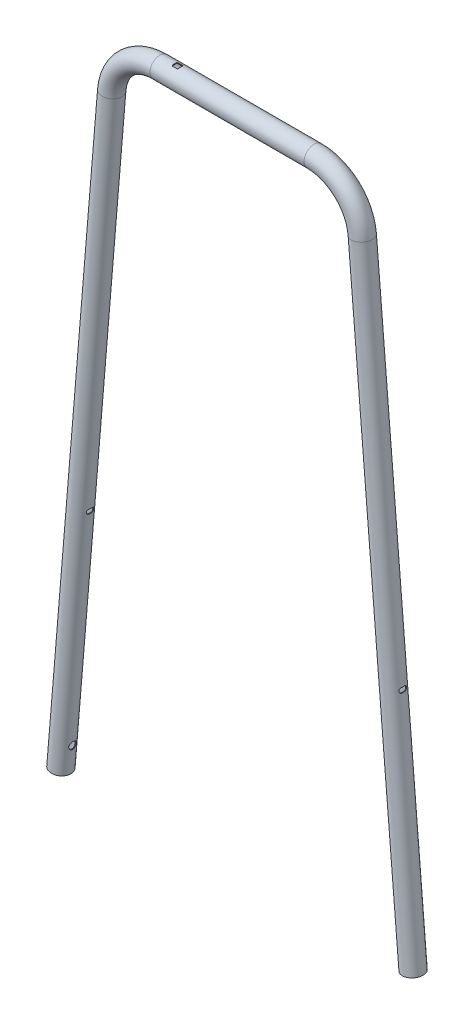
from build123d import *

# Parameters (mm, degrees)
SKETCH2_R           = 11
SKETCH2_R_2         = 10.2
SKETCH17_R          = 4
CUT_EXTRUDE6_DEPTH  = 50
CUT_EXTRUDE7_DEPTH  = 50
SKETCH19_R          = 4
CUT_EXTRUDE8_DEPTH  = 50
SKETCH20_R          = 3.1
CUT_EXTRUDE9_DEPTH  = 50
CUT_EXTRUDE10_DEPTH = 10


with BuildPart() as part:
    # Sweep2: sweep along a path in Sketch1
    with BuildLine(Plane.XY) as sweep2_path:
        Line((193, -162.284032228), (137.294983498, 508.10480277))
        ThreePointArc((137.294983498, 508.10480277), (120.368457539, 542.713456504), (84.477011865, 556.715967772))
        Line((84.477011865, 556.715967772), (-84.477011865, 556.715967772))
        ThreePointArc((-84.477011865, 556.715967772), (-120.368457539, 542.713456504), (-137.294983498, 508.10480277))
        Line((-137.294983498, 508.10480277), (-193, -162.284032228))
    # Sketch2 → Sweep2 (sweep)
    with BuildSketch(Plane(origin=(-193, -162.284032228, 0), x_dir=(-0.9965655024977618, 0.08280820751220104, 0), z_dir=(-0.08280820751220103, -0.9965655024977617, 0))):
        Circle(SKETCH2_R)
        Circle(SKETCH2_R_2, mode=Mode.SUBTRACT)
    sweep(path=sweep2_path.line)

    # Sketch17 → Cut-Extrude6 (cut)
    with BuildSketch(Plane(origin=(-193, -162.284032228, 0), x_dir=(0, 0, 1), z_dir=(-0.9965655024977617, 0.08280820751220212, 0))):
        with Locations((0, 28.3)):
            Circle(SKETCH17_R)
    cut_extrude6 = extrude(amount=-CUT_EXTRUDE6_DEPTH, mode=Mode.SUBTRACT)

    # Sketch18 → Cut-Extrude7 (cut, symmetric)
    with BuildSketch(Plane(origin=(-193, -162.284032228, 0), x_dir=(0, 0, 1), z_dir=(-0.9965655024977617, 0.08280820751220212, 0))):
        with BuildLine():
            Line((-2, 263.803489028), (2, 263.803489028))
            ThreePointArc((2, 263.803489028), (3.414213562, 263.21770259), (4, 261.803489028))
            Line((4, 261.803489028), (4, 260.803489028))
            ThreePointArc((4, 260.803489028), (3.414213562, 259.389275466), (2, 258.803489028))
            Line((2, 258.803489028), (-2, 258.803489028))
            ThreePointArc((-2, 258.803489028), (-3.414213562, 259.389275466), (-4, 260.803489028))
            Line((-4, 260.803489028), (-4, 261.803489028))
            ThreePointArc((-4, 261.803489028), (-3.414213562, 263.21770259), (-2, 263.803489028))
        make_face()
    cut_extrude7 = extrude(amount=CUT_EXTRUDE7_DEPTH, both=True, mode=Mode.SUBTRACT)

    # Mirror2: Cut-Extrude6, Cut-Extrude7 across plane
    add(cut_extrude6.mirror(Plane(origin=(0, 0, 0), x_dir=(0, 0, 1), z_dir=(1, 0, 0))), mode=Mode.SUBTRACT)
    add(cut_extrude7.mirror(Plane(origin=(0, 0, 0), x_dir=(0, 0, 1), z_dir=(1, 0, 0))), mode=Mode.SUBTRACT)

    # Sketch19 → Cut-Extrude8 (cut)
    with BuildSketch(Plane(origin=(-193, -162.284032228, 0), x_dir=(0, 0, 1), z_dir=(-0.9965655024977617, 0.08280820751220212, 0))):
        with Locations((0, 498)):
            Circle(SKETCH19_R)
    extrude(amount=CUT_EXTRUDE8_DEPTH, mode=Mode.SUBTRACT)

    # Sketch20 → Cut-Extrude9 (cut)
    with BuildSketch(Plane(origin=(0, 567.715967772, 0), x_dir=(1, 0, 0), z_dir=(0, 1, 0))):
        with Locations((-65.062220527, 0)):
            Circle(SKETCH20_R)
    extrude(amount=-CUT_EXTRUDE9_DEPTH, mode=Mode.SUBTRACT)

    # Sketch21 → Cut-Extrude10 (cut)
    with BuildSketch(Plane(origin=(0, 567.715967772, 0), x_dir=(1, 0, 0), z_dir=(0, 1, 0))):
        with BuildLine():
            Line((-67.312220527, -3.1), (-62.812220527, -3.1))
            ThreePointArc((-62.812220527, -3.1), (-62.105113746, -2.807106781), (-61.812220527, -2.1))
            Line((-61.812220527, -2.1), (-61.812220527, 2.1))
            ThreePointArc((-61.812220527, 2.1), (-62.105113746, 2.807106781), (-62.812220527, 3.1))
            Line((-62.812220527, 3.1), (-67.312220527, 3.1))
            ThreePointArc((-67.312220527, 3.1), (-68.019327309, 2.807106781), (-68.312220527, 2.1))
            Line((-68.312220527, 2.1), (-68.312220527, -2.1))
            ThreePointArc((-68.312220527, -2.1), (-68.019327309, -2.807106781), (-67.312220527, -3.1))
        make_face()
    extrude(amount=-CUT_EXTRUDE10_DEPTH, mode=Mode.SUBTRACT)


solid = part.part
